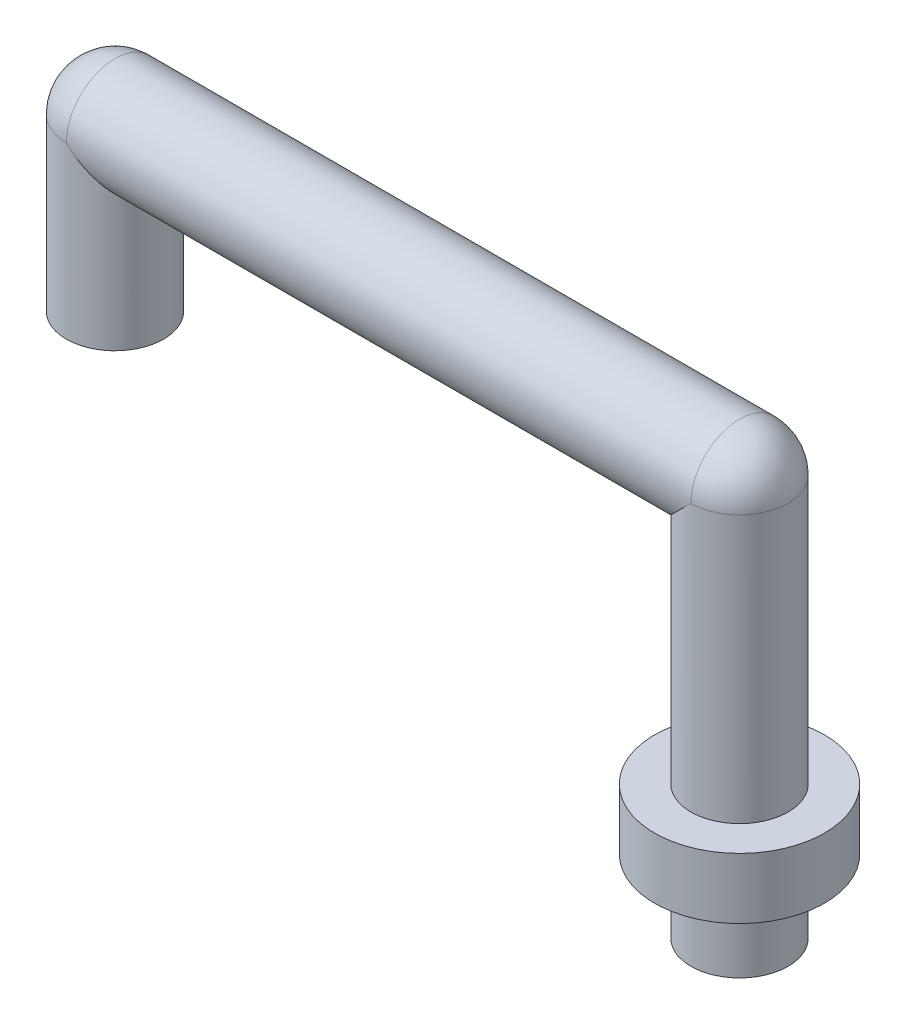
from build123d import *

# Parameters (mm, degrees)
SKETCH2_R           = 5.08
BOSS_EXTRUDE2_DEPTH = 41.91
SKETCH3_W           = 8.89
SKETCH3_H           = 6.35


with BuildPart() as part:
    # Sketch2 → Boss-Extrude2 (new body)
    with BuildSketch(Plane(origin=(0, 0, 0), x_dir=(-1, 0, 0), z_dir=(0, 1, 0))):
        with Locations(Location((0, 0, 0), (0, 0, 90))):
            Circle(SKETCH2_R)
    extrude(amount=BOSS_EXTRUDE2_DEPTH)

    # Sketch3 → Revolve1 (revolve)
    with BuildSketch(Plane.XY, mode=Mode.PRIVATE) as revolve1_sk:
        with Locations((-4.445, 10.795)):
            Rectangle(SKETCH3_W, SKETCH3_H)
    revolve(revolve1_sk.sketch.rotate(Axis((0, 0, 0), (0, 1, 0)), 270), axis=Axis((0, 0, 0), (0, 1, 0)))

    # Sketch4 → Revolve2 (revolve)
    with BuildSketch(Plane(origin=(0, 41.91, 0), x_dir=(1, 0, 0), z_dir=(0, 1, 0)), mode=Mode.PRIVATE) as revolve2_sk:
        with BuildLine():
            Line((0, 5.08), (-65.278, 5.08))
            Line((-65.278, 5.08), (-65.278, 0))
            Line((-65.278, 0), (5.08, 0))
            ThreePointArc((5.08, 0), (3.592102448, 3.592102448), (0, 5.08))
        make_face()
    revolve(revolve2_sk.sketch.rotate(Axis((-65.278, 41.91, 0), (1, 0, 0)), 180), axis=Axis((-65.278, 41.91, 0), (1, 0, 0)))

    # Sketch5 → Revolve3 (revolve)
    with BuildSketch(Plane.ZY.offset(65.278), mode=Mode.PRIVATE) as revolve3_sk:
        with BuildLine():
            Line((0, 46.99), (0, 24.13))
            Line((0, 24.13), (-5.08, 24.13))
            Line((-5.08, 24.13), (-5.08, 41.91))
            ThreePointArc((-5.08, 41.91), (-3.592102448, 45.502102448), (0, 46.99))
        make_face()
    revolve(revolve3_sk.sketch.rotate(Axis((-65.278, 46.99, 0), (0, -1, 0)), 180), axis=Axis((-65.278, 46.99, 0), (0, -1, 0)))


solid = part.part
